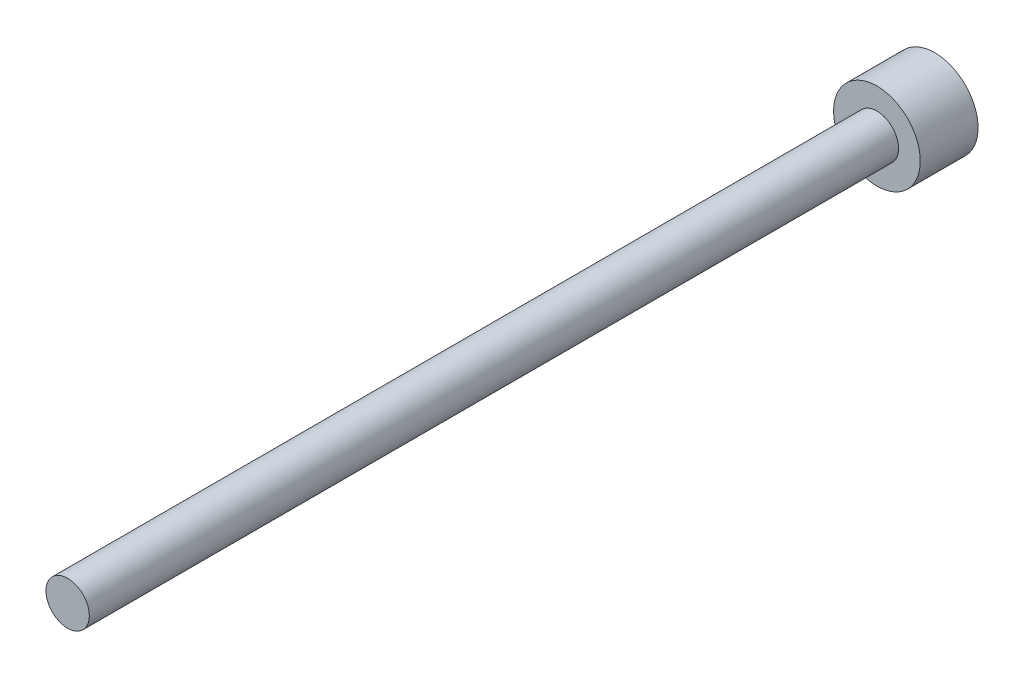
from build123d import *

# Parameters (mm, degrees)
SKETCH1_R           = 2.38125
BOSS_EXTRUDE1_DEPTH = 88.9
SKETCH2_R           = 4.7625
BOSS_EXTRUDE2_DEPTH = 6.35


with BuildPart() as part:
    # Sketch1 → Boss-Extrude1 (new body)
    with BuildSketch(Plane.XY):
        Circle(SKETCH1_R)
    extrude(amount=BOSS_EXTRUDE1_DEPTH)

    # Sketch2 → Boss-Extrude2 (add)
    with BuildSketch(Plane(origin=(0, 0, 0), x_dir=(-1, 0, 0), z_dir=(0, 0, -1))):
        Circle(SKETCH2_R)
    extrude(amount=BOSS_EXTRUDE2_DEPTH)


solid = part.part
